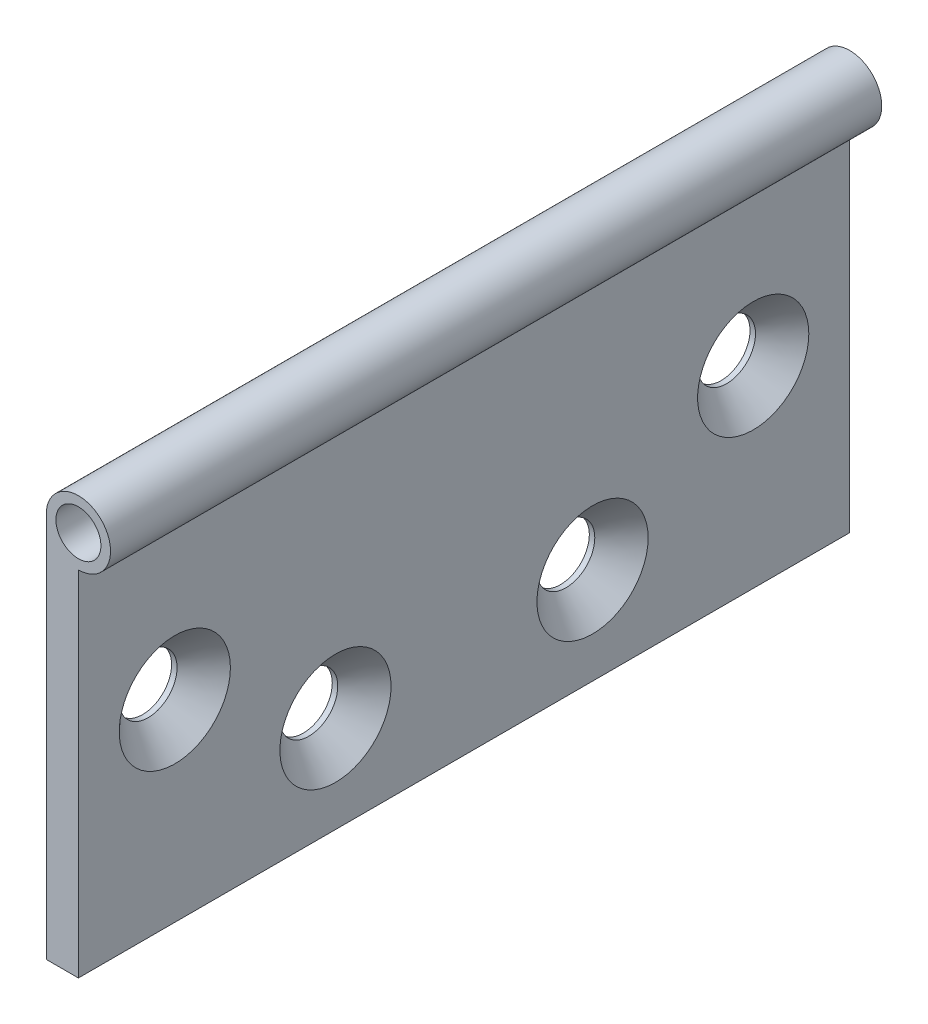
from build123d import *

# Parameters (mm, degrees)
SKETCH1_W                                      = 5
SKETCH1_H                                      = 60
EXTRUDE_THIN1_DEPTH                            = 60
SKETCH2_R                                      = 5
SKETCH3_R                                      = 3.5
CUT_EXTRUDE1_DEPTH                             = 137.839321834
CSK_FOR_M8_FLAT_HEAD_MACHINE_SCREW1_AT_2_COUNT = 2
CSK_FOR_M8_FLAT_HEAD_MACHINE_SCREW1_AT_2_PITCH = 29.154759474


with BuildPart() as part:
    # Sketch1 → Extrude-Thin1 (new, symmetric)
    with BuildSketch(Plane.XY):
        with Locations((2.5, 30)):
            Rectangle(SKETCH1_W, SKETCH1_H)
    extrude(amount=EXTRUDE_THIN1_DEPTH, both=True)

    # Sweep1: sweep along a curve in space
    with BuildLine() as sweep1_path:
        Line((5, 60, 60), (5, 60, -60))
    # Sketch2 → Sweep1 (sweep)
    with BuildSketch(Plane.XY.offset(60)):
        with Locations((5, 60)):
            Circle(SKETCH2_R)
    sweep(path=sweep1_path.line)

    # Sketch3 → Cut-Extrude1 (cut, through all)
    with BuildSketch(Plane.XY.offset(60)):
        with Locations((5, 60)):
            Circle(SKETCH3_R)
    extrude(amount=-CUT_EXTRUDE1_DEPTH, mode=Mode.SUBTRACT)

    # Sketch5 → CSK for M8 Flat Head Machine Screw1 (revolve, cut)
    with BuildSketch(Plane(origin=(5, 30, 45), x_dir=(0, 0, -1), z_dir=(0, 1, 0))):
        Polygon((0, 0), (0, 5), (4.5, 5), (4.5, 4.15), (8.65, 0), align=None)
    csk_for_m8_flat_head_machine_screw1 = revolve(axis=Axis((11.35, 30, 45), (-1, 0, 0)), mode=Mode.SUBTRACT)

    # CSK for M8 Flat Head Machine Screw1 at 2: CSK for M8 Flat Head Machine Screw1 ×2
    with Locations(*[Vector(0, -0.5144957554275265, -0.8574929257125442) * (i * CSK_FOR_M8_FLAT_HEAD_MACHINE_SCREW1_AT_2_PITCH) for i in range(1, CSK_FOR_M8_FLAT_HEAD_MACHINE_SCREW1_AT_2_COUNT)]):
        add(csk_for_m8_flat_head_machine_screw1, mode=Mode.SUBTRACT)

    # Mirror1: CSK for M8 Flat Head Machine Screw1 across plane
    add(csk_for_m8_flat_head_machine_screw1.mirror(Plane.XY), mode=Mode.SUBTRACT)

    # Mirror1 copy 1 sketch → Mirror1 copy 1 (revolve, cut)
    with BuildSketch(Plane(origin=(5, 15, -20), x_dir=(0, 0, 1), z_dir=(0, 1, 0))):
        Polygon((0, 0), (0, -5), (4.5, -5), (4.5, -4.15), (8.65, 0), align=None)
    revolve(axis=Axis((11.35, 15, -20), (1, 0, 0)), mode=Mode.SUBTRACT)


solid = part.part
